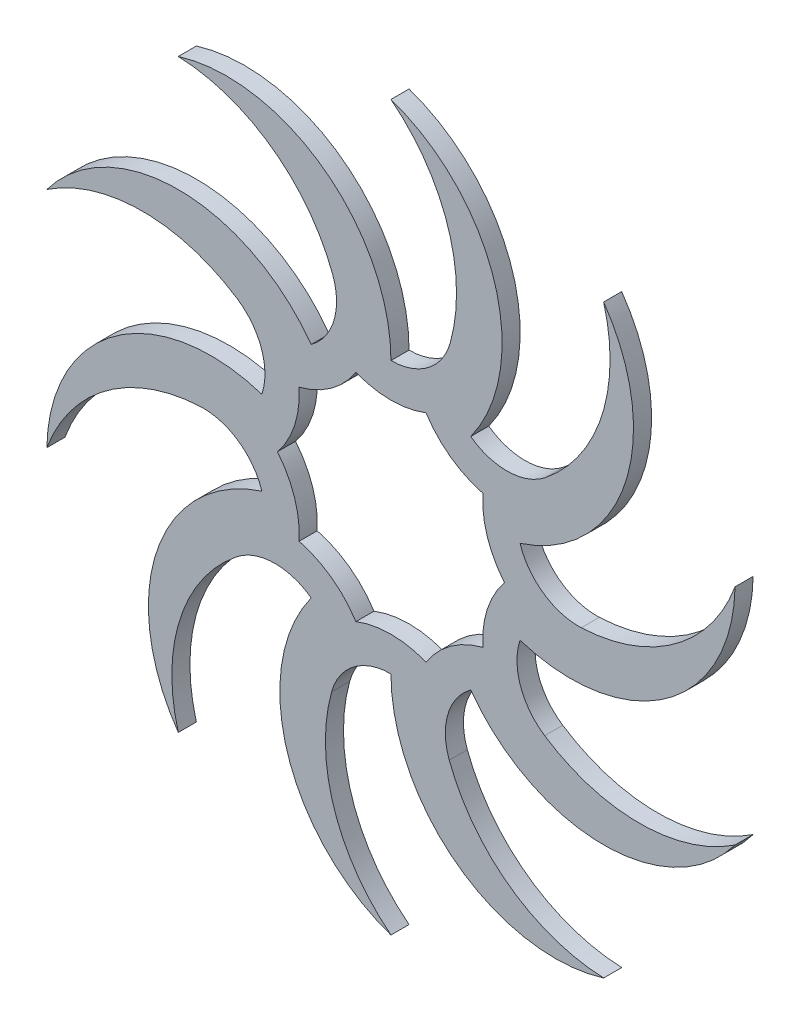
from build123d import *

# Parameters (mm, degrees)
BOSS_EXTRUDE1_DEPTH = 2.54
CIRPATTERN1_COUNT   = 10
CUT_EXTRUDE1_REACH  = 72.152


with BuildPart() as part:
    # Sketch1 → Boss-Extrude1 (new body)
    with BuildSketch(Plane.XY):
        with BuildLine():
            Line((0, 0), (11.197309056, 15.411773743))
            ThreePointArc((11.197309056, 15.411773743), (14.528469134, 35.931399889), (0, 50.8))
            ThreePointArc((0, 50.8), (8.000279424, 39.356176552), (8.334788134, 25.39717695))
            ThreePointArc((8.334788134, 25.39717695), (5.238209343, 20.817448624), (0, 19.05))
            Line((0, 19.05), (0, 0))
        make_face()
    extrude(amount=BOSS_EXTRUDE1_DEPTH)


with BuildPart() as cirpattern1_1:
    # CirPattern1: pattern copy
    add(part.part.rotate(Axis((0, 0, 0), (0, 0, 1)), 1 * 360 / CIRPATTERN1_COUNT))


with BuildPart() as cirpattern1_2:
    # CirPattern1: pattern copy
    add(part.part.rotate(Axis((0, 0, 0), (0, 0, 1)), 2 * 360 / CIRPATTERN1_COUNT))


with BuildPart() as cirpattern1_3:
    # CirPattern1: pattern copy
    add(part.part.rotate(Axis((0, 0, 0), (0, 0, 1)), 3 * 360 / CIRPATTERN1_COUNT))


with BuildPart() as cirpattern1_4:
    # CirPattern1: pattern copy
    add(part.part.rotate(Axis((0, 0, 0), (0, 0, 1)), 4 * 360 / CIRPATTERN1_COUNT))


with BuildPart() as cirpattern1_5:
    # CirPattern1: pattern copy
    add(part.part.rotate(Axis((0, 0, 0), (0, 0, 1)), 5 * 360 / CIRPATTERN1_COUNT))


with BuildPart() as cirpattern1_6:
    # CirPattern1: pattern copy
    add(part.part.rotate(Axis((0, 0, 0), (0, 0, 1)), 6 * 360 / CIRPATTERN1_COUNT))


with BuildPart() as cirpattern1_7:
    # CirPattern1: pattern copy
    add(part.part.rotate(Axis((0, 0, 0), (0, 0, 1)), 7 * 360 / CIRPATTERN1_COUNT))


with BuildPart() as cirpattern1_8:
    # CirPattern1: pattern copy
    add(part.part.rotate(Axis((0, 0, 0), (0, 0, 1)), 8 * 360 / CIRPATTERN1_COUNT))


with BuildPart() as cirpattern1_9:
    # CirPattern1: pattern copy
    add(part.part.rotate(Axis((0, 0, 0), (0, 0, 1)), 9 * 360 / CIRPATTERN1_COUNT))


with BuildPart() as cirpattern1_8_1:
    add(cirpattern1_8.part)

    # Combine1: union CirPattern1_3, CirPattern1_7, CirPattern1_2, CirPattern1_6, part, CirPattern1_1, CirPattern1_5, CirPattern1_9, CirPattern1_4
    add(cirpattern1_3.part)
    add(cirpattern1_7.part)
    add(cirpattern1_2.part)
    add(cirpattern1_6.part)
    add(part.part)
    add(cirpattern1_1.part)
    add(cirpattern1_5.part)
    add(cirpattern1_9.part)
    add(cirpattern1_4.part)

    # Sketch2 → Cut-Extrude1 (cut, up to next)
    with BuildSketch(Plane.XY.offset(2.54), mode=Mode.PRIVATE) as cut_extrude1_sk1:
        with BuildLine():
            ThreePointArc((12.892749535, 9.36713084), (13.527827888, 4.395457728), (15.936314842, 0))
            ThreePointArc((15.936314842, 0), (13.527827888, -4.395457728), (12.892749535, -9.36713084))
            ThreePointArc((12.892749535, -9.36713084), (8.360657429, -11.507457728), (4.924592114, -15.156336076))
            ThreePointArc((4.924592114, -15.156336076), (0, -14.224), (-4.924592114, -15.156336076))
            ThreePointArc((-4.924592114, -15.156336076), (-8.360657429, -11.507457728), (-12.892749535, -9.36713084))
            ThreePointArc((-12.892749535, -9.36713084), (-13.527827888, -4.395457728), (-15.936314842, 0))
            ThreePointArc((-15.936314842, 0), (-13.527827888, 4.395457728), (-12.892749535, 9.36713084))
            ThreePointArc((-12.892749535, 9.36713084), (-8.360657429, 11.507457728), (-4.924592114, 15.156336076))
            ThreePointArc((-4.924592114, 15.156336076), (0, 14.224), (4.924592114, 15.156336076))
            ThreePointArc((4.924592114, 15.156336076), (8.360657429, 11.507457728), (12.892749535, 9.36713084))
        make_face()
    cut_extrude1_tool1 = extrude(cut_extrude1_sk1.sketch, amount=-CUT_EXTRUDE1_REACH, mode=Mode.PRIVATE) & cirpattern1_8_1.part
    add(cut_extrude1_tool1.solids().sort_by_distance((0, 0, 2.54))[0], mode=Mode.SUBTRACT)


solid = cirpattern1_8_1.part
